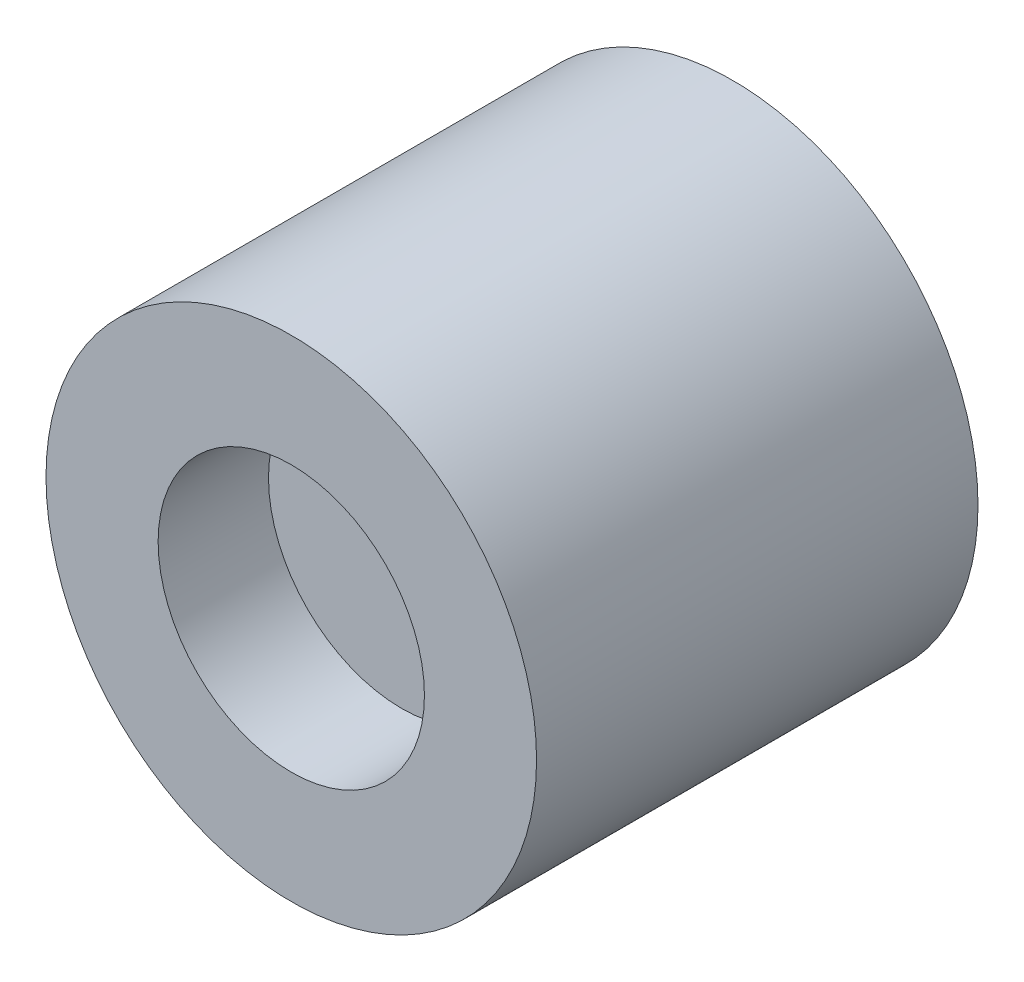
from build123d import *

# Parameters (mm, degrees)
SKETCH1_R           = 4.445
BOSS_EXTRUDE1_DEPTH = 8
SKETCH2_R           = 2.4765
CUT_EXTRUDE1_DEPTH  = 3
SKETCH3_R           = 2.413
CUT_EXTRUDE2_DEPTH  = 2


with BuildPart() as part:
    # Sketch1 → Boss-Extrude1 (new body)
    with BuildSketch(Plane.XY):
        Circle(SKETCH1_R)
    extrude(amount=BOSS_EXTRUDE1_DEPTH)

    # Sketch2 → Cut-Extrude1 (cut)
    with BuildSketch(Plane(origin=(0, 0, 0), x_dir=(-1, 0, 0), z_dir=(0, 0, -1))):
        Circle(SKETCH2_R)
    extrude(amount=-CUT_EXTRUDE1_DEPTH, mode=Mode.SUBTRACT)

    # Sketch3 → Cut-Extrude2 (cut)
    with BuildSketch(Plane.XY.offset(8)):
        Circle(SKETCH3_R)
    extrude(amount=-CUT_EXTRUDE2_DEPTH, mode=Mode.SUBTRACT)


solid = part.part
